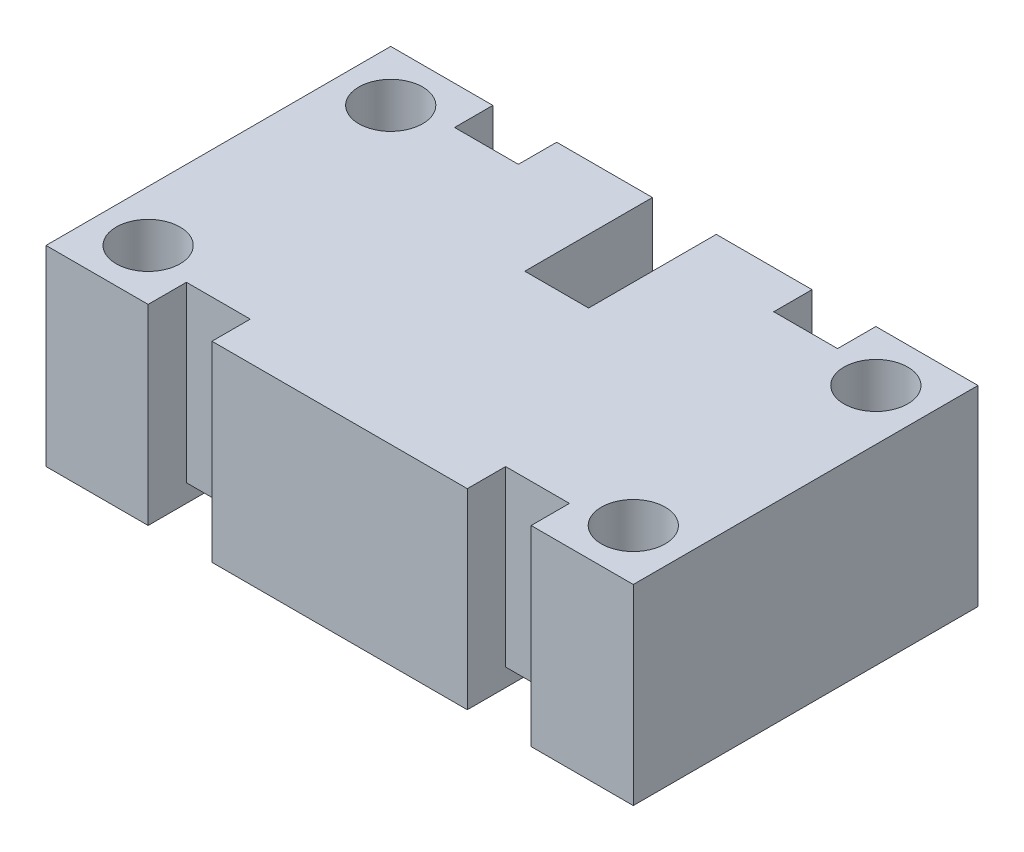
from build123d import *

# Parameters (mm, degrees)
SKETCH1_R           = 3.175
BOSS_EXTRUDE1_DEPTH = 19.05
SKETCH1_3_R         = 3.175
SKETCH1_3_R_2       = 2.159
BOSS_EXTRUDE2_DEPTH = 2.54
SKETCH2_W           = 6.35
SKETCH2_H           = 1.778
CUT_EXTRUDE2_DEPTH  = 58.700024564


with BuildPart() as part:
    # Sketch1 → Boss-Extrude1 (new body)
    with BuildSketch(Plane(origin=(0, 0, 0), x_dir=(1, 0, 0), z_dir=(0, 1, 0))):
        Polygon((-5.944680851, 17.581843972), (-16.104680851, 17.581843972), (-16.104680851, -16.708156028), (-5.944680851, -16.708156028), (-5.944680851, -12.898156028), (0.405319149, -12.898156028), (0.405319149, -16.708156028), (25.805319149, -16.708156028), (25.805319149, -12.898156028), (32.155319149, -12.898156028), (32.155319149, -16.708156028), (42.315319149, -16.708156028), (42.315319149, 17.581843972), (32.155319149, 17.581843972), (32.155319149, 13.771843972), (25.805319149, 13.771843972), (25.805319149, 17.581843972), (16.280319149, 17.581843972), (16.280319149, 4.881843972), (9.930319149, 4.881843972), (9.930319149, 17.581843972), (0.405319149, 17.581843972), (0.405319149, 13.771843972), (-5.944680851, 13.771843972), align=None)
        with Locations((-11.024680851, -11.628156028)):
            Circle(SKETCH1_R, mode=Mode.SUBTRACT)
        with Locations((37.235319149, -11.628156028)):
            Circle(SKETCH1_R, mode=Mode.SUBTRACT)
        with Locations((-11.024680851, 12.501843972)):
            Circle(SKETCH1_R, mode=Mode.SUBTRACT)
        with Locations((37.235319149, 12.501843972)):
            Circle(SKETCH1_R, mode=Mode.SUBTRACT)
    extrude(amount=BOSS_EXTRUDE1_DEPTH)

    # Sketch1<3> → Boss-Extrude2 (add)
    # profile 1 of 4: a face of its own
    with BuildSketch(Plane(origin=(0, 0, 0), x_dir=(1, 0, 0), z_dir=(0, 1, 0))):
        with Locations((-11.024680851, 12.501843972)):
            Circle(SKETCH1_3_R)
        with Locations((-11.024680851, 12.501843972)):
            Circle(SKETCH1_3_R_2, mode=Mode.SUBTRACT)
    # profile 2 of 4: a face of its own
    with BuildSketch(Plane(origin=(0, 0, 0), x_dir=(1, 0, 0), z_dir=(0, 1, 0))):
        with Locations((37.235319149, 12.501843972)):
            Circle(SKETCH1_3_R)
        with Locations((37.235319149, 12.501843972)):
            Circle(SKETCH1_3_R_2, mode=Mode.SUBTRACT)
    # profile 3 of 4: a face of its own
    with BuildSketch(Plane(origin=(0, 0, 0), x_dir=(1, 0, 0), z_dir=(0, 1, 0))):
        with Locations((-11.024680851, -11.628156028)):
            Circle(SKETCH1_3_R)
        with Locations((-11.024680851, -11.628156028)):
            Circle(SKETCH1_3_R_2, mode=Mode.SUBTRACT)
    # profile 4 of 4: a face of its own
    with BuildSketch(Plane(origin=(0, 0, 0), x_dir=(1, 0, 0), z_dir=(0, 1, 0))):
        with Locations((37.235319149, -11.628156028)):
            Circle(SKETCH1_3_R)
        with Locations((37.235319149, -11.628156028)):
            Circle(SKETCH1_3_R_2, mode=Mode.SUBTRACT)
    extrude(amount=BOSS_EXTRUDE2_DEPTH)

    # Sketch2 → Cut-Extrude2 (cut, through all)
    with BuildSketch(Plane.XY.offset(16.708156028)):
        with Locations((-2.769680851, 0.889)):
            Rectangle(SKETCH2_W, SKETCH2_H)
        with Locations((28.980319149, 0.889)):
            Rectangle(SKETCH2_W, SKETCH2_H)
    extrude(amount=-CUT_EXTRUDE2_DEPTH, mode=Mode.SUBTRACT)


solid = part.part
